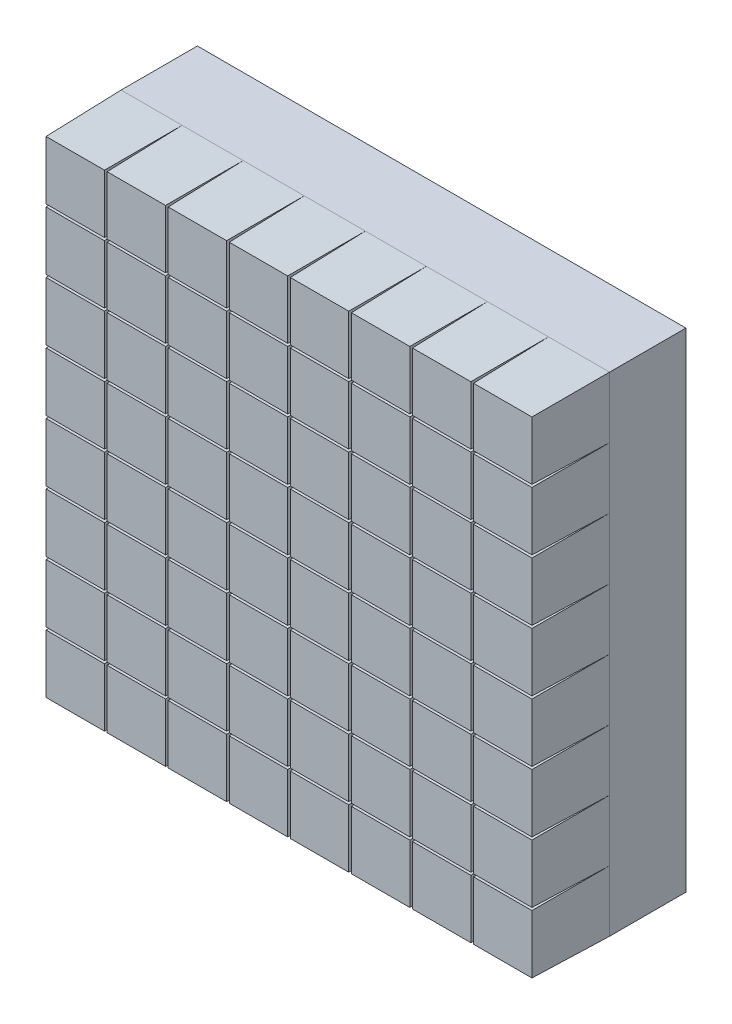
from build123d import *

# Parameters (mm, degrees)
SKETCH_2_W          = 64
SKETCH_2_H          = 64
EXTRUDE_2_DEPTH     = 10
SKETCH_4_W          = 8
SKETCH_4_H          = 8
EXTRUDE_10_DEPTH    = 10
EXTRUDE_10_TAPER    = 1
EXTRUDE_10_2_DEPTH  = 10
EXTRUDE_10_2_TAPER  = 1
EXTRUDE_10_3_DEPTH  = 10
EXTRUDE_10_3_TAPER  = 1
EXTRUDE_10_4_DEPTH  = 10
EXTRUDE_10_4_TAPER  = 1
EXTRUDE_10_5_DEPTH  = 10
EXTRUDE_10_5_TAPER  = 1
EXTRUDE_10_6_DEPTH  = 10
EXTRUDE_10_6_TAPER  = 1
EXTRUDE_10_7_DEPTH  = 10
EXTRUDE_10_7_TAPER  = 1
EXTRUDE_10_8_DEPTH  = 10
EXTRUDE_10_8_TAPER  = 1
EXTRUDE_10_9_DEPTH  = 10
EXTRUDE_10_9_TAPER  = 1
EXTRUDE_10_10_DEPTH = 10
EXTRUDE_10_10_TAPER = 1
EXTRUDE_10_11_DEPTH = 10
EXTRUDE_10_11_TAPER = 1
EXTRUDE_10_12_DEPTH = 10
EXTRUDE_10_12_TAPER = 1
EXTRUDE_10_13_DEPTH = 10
EXTRUDE_10_13_TAPER = 1
EXTRUDE_10_14_DEPTH = 10
EXTRUDE_10_14_TAPER = 1
EXTRUDE_10_15_DEPTH = 10
EXTRUDE_10_15_TAPER = 1
EXTRUDE_10_16_DEPTH = 10
EXTRUDE_10_16_TAPER = 1
EXTRUDE_10_17_DEPTH = 10
EXTRUDE_10_17_TAPER = 1
EXTRUDE_10_18_DEPTH = 10
EXTRUDE_10_18_TAPER = 1
EXTRUDE_10_19_DEPTH = 10
EXTRUDE_10_19_TAPER = 1
EXTRUDE_10_20_DEPTH = 10
EXTRUDE_10_20_TAPER = 1
EXTRUDE_10_21_DEPTH = 10
EXTRUDE_10_21_TAPER = 1
EXTRUDE_10_22_DEPTH = 10
EXTRUDE_10_22_TAPER = 1
EXTRUDE_10_23_DEPTH = 10
EXTRUDE_10_23_TAPER = 1
EXTRUDE_10_24_DEPTH = 10
EXTRUDE_10_24_TAPER = 1
EXTRUDE_10_25_DEPTH = 10
EXTRUDE_10_25_TAPER = 1
EXTRUDE_10_26_DEPTH = 10
EXTRUDE_10_26_TAPER = 1
EXTRUDE_10_27_DEPTH = 10
EXTRUDE_10_27_TAPER = 1
EXTRUDE_10_28_DEPTH = 10
EXTRUDE_10_28_TAPER = 1
EXTRUDE_10_29_DEPTH = 10
EXTRUDE_10_29_TAPER = 1
EXTRUDE_10_30_DEPTH = 10
EXTRUDE_10_30_TAPER = 1
EXTRUDE_10_31_DEPTH = 10
EXTRUDE_10_31_TAPER = 1
EXTRUDE_10_32_DEPTH = 10
EXTRUDE_10_32_TAPER = 1
SKETCH_4_5_W        = 8
SKETCH_4_5_H        = 8
EXTRUDE_11_DEPTH    = 10
EXTRUDE_11_TAPER    = 1
EXTRUDE_11_2_DEPTH  = 10
EXTRUDE_11_2_TAPER  = 1
EXTRUDE_11_3_DEPTH  = 10
EXTRUDE_11_3_TAPER  = 1
EXTRUDE_11_4_DEPTH  = 10
EXTRUDE_11_4_TAPER  = 1
EXTRUDE_11_5_DEPTH  = 10
EXTRUDE_11_5_TAPER  = 1
EXTRUDE_11_6_DEPTH  = 10
EXTRUDE_11_6_TAPER  = 1
EXTRUDE_11_7_DEPTH  = 10
EXTRUDE_11_7_TAPER  = 1
EXTRUDE_11_8_DEPTH  = 10
EXTRUDE_11_8_TAPER  = 1
EXTRUDE_11_9_DEPTH  = 10
EXTRUDE_11_9_TAPER  = 1
EXTRUDE_11_10_DEPTH = 10
EXTRUDE_11_10_TAPER = 1
EXTRUDE_11_11_DEPTH = 10
EXTRUDE_11_11_TAPER = 1
EXTRUDE_11_12_DEPTH = 10
EXTRUDE_11_12_TAPER = 1
EXTRUDE_11_13_DEPTH = 10
EXTRUDE_11_13_TAPER = 1
EXTRUDE_11_14_DEPTH = 10
EXTRUDE_11_14_TAPER = 1
EXTRUDE_11_15_DEPTH = 10
EXTRUDE_11_15_TAPER = 1
EXTRUDE_11_16_DEPTH = 10
EXTRUDE_11_16_TAPER = 1
EXTRUDE_11_17_DEPTH = 10
EXTRUDE_11_17_TAPER = 1
EXTRUDE_11_18_DEPTH = 10
EXTRUDE_11_18_TAPER = 1
EXTRUDE_11_19_DEPTH = 10
EXTRUDE_11_19_TAPER = 1
EXTRUDE_11_20_DEPTH = 10
EXTRUDE_11_20_TAPER = 1
EXTRUDE_11_21_DEPTH = 10
EXTRUDE_11_21_TAPER = 1
EXTRUDE_11_22_DEPTH = 10
EXTRUDE_11_22_TAPER = 1
EXTRUDE_11_23_DEPTH = 10
EXTRUDE_11_23_TAPER = 1
EXTRUDE_11_24_DEPTH = 10
EXTRUDE_11_24_TAPER = 1
EXTRUDE_11_25_DEPTH = 10
EXTRUDE_11_25_TAPER = 1
EXTRUDE_11_26_DEPTH = 10
EXTRUDE_11_26_TAPER = 1
EXTRUDE_11_27_DEPTH = 10
EXTRUDE_11_27_TAPER = 1
EXTRUDE_11_28_DEPTH = 10
EXTRUDE_11_28_TAPER = 1
EXTRUDE_11_29_DEPTH = 10
EXTRUDE_11_29_TAPER = 1
EXTRUDE_11_30_DEPTH = 10
EXTRUDE_11_30_TAPER = 1
EXTRUDE_11_31_DEPTH = 10
EXTRUDE_11_31_TAPER = 1
EXTRUDE_11_32_DEPTH = 10
EXTRUDE_11_32_TAPER = 1


with BuildPart() as part:
    # Эскиз2 → Бобышка-Вытянуть2 (new body)
    with BuildSketch(Plane.XY):
        with Locations((32, 32)):
            Rectangle(SKETCH_2_W, SKETCH_2_H)
    extrude(amount=EXTRUDE_2_DEPTH)


with BuildPart() as body_2:
    # Эскиз4 → Бобышка-Вытянуть10 (new body)
    with BuildSketch(Plane.XY.offset(10)):
        with Locations((4, 60)):
            Rectangle(SKETCH_4_W, SKETCH_4_H)
    extrude(amount=EXTRUDE_10_DEPTH, taper=EXTRUDE_10_TAPER)


with BuildPart() as body_3:
    # Эскиз4 → Extrude 10 2 (new body)
    with BuildSketch(Plane.XY.offset(10)):
        with Locations((4, 44)):
            Rectangle(SKETCH_4_W, SKETCH_4_H)
    extrude(amount=EXTRUDE_10_2_DEPTH, taper=EXTRUDE_10_2_TAPER)


with BuildPart() as body_4:
    # Эскиз4 → Extrude 10 3 (new body)
    with BuildSketch(Plane.XY.offset(10)):
        with Locations((12, 52)):
            Rectangle(SKETCH_4_W, SKETCH_4_H)
    extrude(amount=EXTRUDE_10_3_DEPTH, taper=EXTRUDE_10_3_TAPER)


with BuildPart() as body_5:
    # Эскиз4 → Extrude 10 4 (new body)
    with BuildSketch(Plane.XY.offset(10)):
        with Locations((20, 60)):
            Rectangle(SKETCH_4_W, SKETCH_4_H)
    extrude(amount=EXTRUDE_10_4_DEPTH, taper=EXTRUDE_10_4_TAPER)


with BuildPart() as body_6:
    # Эскиз4 → Extrude 10 5 (new body)
    with BuildSketch(Plane.XY.offset(10)):
        with Locations((4, 28)):
            Rectangle(SKETCH_4_W, SKETCH_4_H)
    extrude(amount=EXTRUDE_10_5_DEPTH, taper=EXTRUDE_10_5_TAPER)


with BuildPart() as body_7:
    # Эскиз4 → Extrude 10 6 (new body)
    with BuildSketch(Plane.XY.offset(10)):
        with Locations((12, 36)):
            Rectangle(SKETCH_4_W, SKETCH_4_H)
    extrude(amount=EXTRUDE_10_6_DEPTH, taper=EXTRUDE_10_6_TAPER)


with BuildPart() as body_8:
    # Эскиз4 → Extrude 10 7 (new body)
    with BuildSketch(Plane.XY.offset(10)):
        with Locations((20, 44)):
            Rectangle(SKETCH_4_W, SKETCH_4_H)
    extrude(amount=EXTRUDE_10_7_DEPTH, taper=EXTRUDE_10_7_TAPER)


with BuildPart() as body_9:
    # Эскиз4 → Extrude 10 8 (new body)
    with BuildSketch(Plane.XY.offset(10)):
        with Locations((28, 52)):
            Rectangle(SKETCH_4_W, SKETCH_4_H)
    extrude(amount=EXTRUDE_10_8_DEPTH, taper=EXTRUDE_10_8_TAPER)


with BuildPart() as body_10:
    # Эскиз4 → Extrude 10 9 (new body)
    with BuildSketch(Plane.XY.offset(10)):
        with Locations((36, 60)):
            Rectangle(SKETCH_4_W, SKETCH_4_H)
    extrude(amount=EXTRUDE_10_9_DEPTH, taper=EXTRUDE_10_9_TAPER)


with BuildPart() as body_11:
    # Эскиз4 → Extrude 10 10 (new body)
    with BuildSketch(Plane.XY.offset(10)):
        with Locations((4, 12)):
            Rectangle(SKETCH_4_W, SKETCH_4_H)
    extrude(amount=EXTRUDE_10_10_DEPTH, taper=EXTRUDE_10_10_TAPER)


with BuildPart() as body_12:
    # Эскиз4 → Extrude 10 11 (new body)
    with BuildSketch(Plane.XY.offset(10)):
        with Locations((12, 20)):
            Rectangle(SKETCH_4_W, SKETCH_4_H)
    extrude(amount=EXTRUDE_10_11_DEPTH, taper=EXTRUDE_10_11_TAPER)


with BuildPart() as body_13:
    # Эскиз4 → Extrude 10 12 (new body)
    with BuildSketch(Plane.XY.offset(10)):
        with Locations((20, 28)):
            Rectangle(SKETCH_4_W, SKETCH_4_H)
    extrude(amount=EXTRUDE_10_12_DEPTH, taper=EXTRUDE_10_12_TAPER)


with BuildPart() as body_14:
    # Эскиз4 → Extrude 10 13 (new body)
    with BuildSketch(Plane.XY.offset(10)):
        with Locations((28, 36)):
            Rectangle(SKETCH_4_W, SKETCH_4_H)
    extrude(amount=EXTRUDE_10_13_DEPTH, taper=EXTRUDE_10_13_TAPER)


with BuildPart() as body_15:
    # Эскиз4 → Extrude 10 14 (new body)
    with BuildSketch(Plane.XY.offset(10)):
        with Locations((36, 44)):
            Rectangle(SKETCH_4_W, SKETCH_4_H)
    extrude(amount=EXTRUDE_10_14_DEPTH, taper=EXTRUDE_10_14_TAPER)


with BuildPart() as body_16:
    # Эскиз4 → Extrude 10 15 (new body)
    with BuildSketch(Plane.XY.offset(10)):
        with Locations((44, 52)):
            Rectangle(SKETCH_4_W, SKETCH_4_H)
    extrude(amount=EXTRUDE_10_15_DEPTH, taper=EXTRUDE_10_15_TAPER)


with BuildPart() as body_17:
    # Эскиз4 → Extrude 10 16 (new body)
    with BuildSketch(Plane.XY.offset(10)):
        with Locations((52, 60)):
            Rectangle(SKETCH_4_W, SKETCH_4_H)
    extrude(amount=EXTRUDE_10_16_DEPTH, taper=EXTRUDE_10_16_TAPER)


with BuildPart() as body_18:
    # Эскиз4 → Extrude 10 17 (new body)
    with BuildSketch(Plane.XY.offset(10)):
        with Locations((12, 4)):
            Rectangle(SKETCH_4_W, SKETCH_4_H)
    extrude(amount=EXTRUDE_10_17_DEPTH, taper=EXTRUDE_10_17_TAPER)


with BuildPart() as body_19:
    # Эскиз4 → Extrude 10 18 (new body)
    with BuildSketch(Plane.XY.offset(10)):
        with Locations((20, 12)):
            Rectangle(SKETCH_4_W, SKETCH_4_H)
    extrude(amount=EXTRUDE_10_18_DEPTH, taper=EXTRUDE_10_18_TAPER)


with BuildPart() as body_20:
    # Эскиз4 → Extrude 10 19 (new body)
    with BuildSketch(Plane.XY.offset(10)):
        with Locations((28, 20)):
            Rectangle(SKETCH_4_W, SKETCH_4_H)
    extrude(amount=EXTRUDE_10_19_DEPTH, taper=EXTRUDE_10_19_TAPER)


with BuildPart() as body_21:
    # Эскиз4 → Extrude 10 20 (new body)
    with BuildSketch(Plane.XY.offset(10)):
        with Locations((36, 28)):
            Rectangle(SKETCH_4_W, SKETCH_4_H)
    extrude(amount=EXTRUDE_10_20_DEPTH, taper=EXTRUDE_10_20_TAPER)


with BuildPart() as body_22:
    # Эскиз4 → Extrude 10 21 (new body)
    with BuildSketch(Plane.XY.offset(10)):
        with Locations((44, 36)):
            Rectangle(SKETCH_4_W, SKETCH_4_H)
    extrude(amount=EXTRUDE_10_21_DEPTH, taper=EXTRUDE_10_21_TAPER)


with BuildPart() as body_23:
    # Эскиз4 → Extrude 10 22 (new body)
    with BuildSketch(Plane.XY.offset(10)):
        with Locations((52, 44)):
            Rectangle(SKETCH_4_W, SKETCH_4_H)
    extrude(amount=EXTRUDE_10_22_DEPTH, taper=EXTRUDE_10_22_TAPER)


with BuildPart() as body_24:
    # Эскиз4 → Extrude 10 23 (new body)
    with BuildSketch(Plane.XY.offset(10)):
        with Locations((60, 52)):
            Rectangle(SKETCH_4_W, SKETCH_4_H)
    extrude(amount=EXTRUDE_10_23_DEPTH, taper=EXTRUDE_10_23_TAPER)


with BuildPart() as body_25:
    # Эскиз4 → Extrude 10 24 (new body)
    with BuildSketch(Plane.XY.offset(10)):
        with Locations((28, 4)):
            Rectangle(SKETCH_4_W, SKETCH_4_H)
    extrude(amount=EXTRUDE_10_24_DEPTH, taper=EXTRUDE_10_24_TAPER)


with BuildPart() as body_26:
    # Эскиз4 → Extrude 10 25 (new body)
    with BuildSketch(Plane.XY.offset(10)):
        with Locations((36, 12)):
            Rectangle(SKETCH_4_W, SKETCH_4_H)
    extrude(amount=EXTRUDE_10_25_DEPTH, taper=EXTRUDE_10_25_TAPER)


with BuildPart() as body_27:
    # Эскиз4 → Extrude 10 26 (new body)
    with BuildSketch(Plane.XY.offset(10)):
        with Locations((44, 20)):
            Rectangle(SKETCH_4_W, SKETCH_4_H)
    extrude(amount=EXTRUDE_10_26_DEPTH, taper=EXTRUDE_10_26_TAPER)


with BuildPart() as body_28:
    # Эскиз4 → Extrude 10 27 (new body)
    with BuildSketch(Plane.XY.offset(10)):
        with Locations((52, 28)):
            Rectangle(SKETCH_4_W, SKETCH_4_H)
    extrude(amount=EXTRUDE_10_27_DEPTH, taper=EXTRUDE_10_27_TAPER)


with BuildPart() as body_29:
    # Эскиз4 → Extrude 10 28 (new body)
    with BuildSketch(Plane.XY.offset(10)):
        with Locations((60, 36)):
            Rectangle(SKETCH_4_W, SKETCH_4_H)
    extrude(amount=EXTRUDE_10_28_DEPTH, taper=EXTRUDE_10_28_TAPER)


with BuildPart() as body_30:
    # Эскиз4 → Extrude 10 29 (new body)
    with BuildSketch(Plane.XY.offset(10)):
        with Locations((44, 4)):
            Rectangle(SKETCH_4_W, SKETCH_4_H)
    extrude(amount=EXTRUDE_10_29_DEPTH, taper=EXTRUDE_10_29_TAPER)


with BuildPart() as body_31:
    # Эскиз4 → Extrude 10 30 (new body)
    with BuildSketch(Plane.XY.offset(10)):
        with Locations((52, 12)):
            Rectangle(SKETCH_4_W, SKETCH_4_H)
    extrude(amount=EXTRUDE_10_30_DEPTH, taper=EXTRUDE_10_30_TAPER)


with BuildPart() as body_32:
    # Эскиз4 → Extrude 10 31 (new body)
    with BuildSketch(Plane.XY.offset(10)):
        with Locations((60, 20)):
            Rectangle(SKETCH_4_W, SKETCH_4_H)
    extrude(amount=EXTRUDE_10_31_DEPTH, taper=EXTRUDE_10_31_TAPER)


with BuildPart() as body_33:
    # Эскиз4 → Extrude 10 32 (new body)
    with BuildSketch(Plane.XY.offset(10)):
        with Locations((60, 4)):
            Rectangle(SKETCH_4_W, SKETCH_4_H)
    extrude(amount=EXTRUDE_10_32_DEPTH, taper=EXTRUDE_10_32_TAPER)


with BuildPart() as body_34:
    # Эскиз4<5> → Бобышка-Вытянуть11 (new body)
    with BuildSketch(Plane.XY.offset(10)):
        with Locations((4, 52)):
            Rectangle(SKETCH_4_5_W, SKETCH_4_5_H)
    extrude(amount=EXTRUDE_11_DEPTH, taper=EXTRUDE_11_TAPER)


with BuildPart() as body_35:
    # Эскиз4<5> → Extrude 11 2 (new body)
    with BuildSketch(Plane.XY.offset(10)):
        with Locations((12, 60)):
            Rectangle(SKETCH_4_5_W, SKETCH_4_5_H)
    extrude(amount=EXTRUDE_11_2_DEPTH, taper=EXTRUDE_11_2_TAPER)


with BuildPart() as body_36:
    # Эскиз4<5> → Extrude 11 3 (new body)
    with BuildSketch(Plane.XY.offset(10)):
        with Locations((4, 36)):
            Rectangle(SKETCH_4_5_W, SKETCH_4_5_H)
    extrude(amount=EXTRUDE_11_3_DEPTH, taper=EXTRUDE_11_3_TAPER)


with BuildPart() as body_37:
    # Эскиз4<5> → Extrude 11 4 (new body)
    with BuildSketch(Plane.XY.offset(10)):
        with Locations((12, 44)):
            Rectangle(SKETCH_4_5_W, SKETCH_4_5_H)
    extrude(amount=EXTRUDE_11_4_DEPTH, taper=EXTRUDE_11_4_TAPER)


with BuildPart() as body_38:
    # Эскиз4<5> → Extrude 11 5 (new body)
    with BuildSketch(Plane.XY.offset(10)):
        with Locations((20, 52)):
            Rectangle(SKETCH_4_5_W, SKETCH_4_5_H)
    extrude(amount=EXTRUDE_11_5_DEPTH, taper=EXTRUDE_11_5_TAPER)


with BuildPart() as body_39:
    # Эскиз4<5> → Extrude 11 6 (new body)
    with BuildSketch(Plane.XY.offset(10)):
        with Locations((28, 60)):
            Rectangle(SKETCH_4_5_W, SKETCH_4_5_H)
    extrude(amount=EXTRUDE_11_6_DEPTH, taper=EXTRUDE_11_6_TAPER)


with BuildPart() as body_40:
    # Эскиз4<5> → Extrude 11 7 (new body)
    with BuildSketch(Plane.XY.offset(10)):
        with Locations((4, 20)):
            Rectangle(SKETCH_4_5_W, SKETCH_4_5_H)
    extrude(amount=EXTRUDE_11_7_DEPTH, taper=EXTRUDE_11_7_TAPER)


with BuildPart() as body_41:
    # Эскиз4<5> → Extrude 11 8 (new body)
    with BuildSketch(Plane.XY.offset(10)):
        with Locations((12, 28)):
            Rectangle(SKETCH_4_5_W, SKETCH_4_5_H)
    extrude(amount=EXTRUDE_11_8_DEPTH, taper=EXTRUDE_11_8_TAPER)


with BuildPart() as body_42:
    # Эскиз4<5> → Extrude 11 9 (new body)
    with BuildSketch(Plane.XY.offset(10)):
        with Locations((20, 36)):
            Rectangle(SKETCH_4_5_W, SKETCH_4_5_H)
    extrude(amount=EXTRUDE_11_9_DEPTH, taper=EXTRUDE_11_9_TAPER)


with BuildPart() as body_43:
    # Эскиз4<5> → Extrude 11 10 (new body)
    with BuildSketch(Plane.XY.offset(10)):
        with Locations((28, 44)):
            Rectangle(SKETCH_4_5_W, SKETCH_4_5_H)
    extrude(amount=EXTRUDE_11_10_DEPTH, taper=EXTRUDE_11_10_TAPER)


with BuildPart() as body_44:
    # Эскиз4<5> → Extrude 11 11 (new body)
    with BuildSketch(Plane.XY.offset(10)):
        with Locations((36, 52)):
            Rectangle(SKETCH_4_5_W, SKETCH_4_5_H)
    extrude(amount=EXTRUDE_11_11_DEPTH, taper=EXTRUDE_11_11_TAPER)


with BuildPart() as body_45:
    # Эскиз4<5> → Extrude 11 12 (new body)
    with BuildSketch(Plane.XY.offset(10)):
        with Locations((44, 60)):
            Rectangle(SKETCH_4_5_W, SKETCH_4_5_H)
    extrude(amount=EXTRUDE_11_12_DEPTH, taper=EXTRUDE_11_12_TAPER)


with BuildPart() as body_46:
    # Эскиз4<5> → Extrude 11 13 (new body)
    with BuildSketch(Plane.XY.offset(10)):
        with Locations((4, 4)):
            Rectangle(SKETCH_4_5_W, SKETCH_4_5_H)
    extrude(amount=EXTRUDE_11_13_DEPTH, taper=EXTRUDE_11_13_TAPER)


with BuildPart() as body_47:
    # Эскиз4<5> → Extrude 11 14 (new body)
    with BuildSketch(Plane.XY.offset(10)):
        with Locations((12, 12)):
            Rectangle(SKETCH_4_5_W, SKETCH_4_5_H)
    extrude(amount=EXTRUDE_11_14_DEPTH, taper=EXTRUDE_11_14_TAPER)


with BuildPart() as body_48:
    # Эскиз4<5> → Extrude 11 15 (new body)
    with BuildSketch(Plane.XY.offset(10)):
        with Locations((20, 20)):
            Rectangle(SKETCH_4_5_W, SKETCH_4_5_H)
    extrude(amount=EXTRUDE_11_15_DEPTH, taper=EXTRUDE_11_15_TAPER)


with BuildPart() as body_49:
    # Эскиз4<5> → Extrude 11 16 (new body)
    with BuildSketch(Plane.XY.offset(10)):
        with Locations((28, 28)):
            Rectangle(SKETCH_4_5_W, SKETCH_4_5_H)
    extrude(amount=EXTRUDE_11_16_DEPTH, taper=EXTRUDE_11_16_TAPER)


with BuildPart() as body_50:
    # Эскиз4<5> → Extrude 11 17 (new body)
    with BuildSketch(Plane.XY.offset(10)):
        with Locations((36, 36)):
            Rectangle(SKETCH_4_5_W, SKETCH_4_5_H)
    extrude(amount=EXTRUDE_11_17_DEPTH, taper=EXTRUDE_11_17_TAPER)


with BuildPart() as body_51:
    # Эскиз4<5> → Extrude 11 18 (new body)
    with BuildSketch(Plane.XY.offset(10)):
        with Locations((44, 44)):
            Rectangle(SKETCH_4_5_W, SKETCH_4_5_H)
    extrude(amount=EXTRUDE_11_18_DEPTH, taper=EXTRUDE_11_18_TAPER)


with BuildPart() as body_52:
    # Эскиз4<5> → Extrude 11 19 (new body)
    with BuildSketch(Plane.XY.offset(10)):
        with Locations((52, 52)):
            Rectangle(SKETCH_4_5_W, SKETCH_4_5_H)
    extrude(amount=EXTRUDE_11_19_DEPTH, taper=EXTRUDE_11_19_TAPER)


with BuildPart() as body_53:
    # Эскиз4<5> → Extrude 11 20 (new body)
    with BuildSketch(Plane.XY.offset(10)):
        with Locations((60, 60)):
            Rectangle(SKETCH_4_5_W, SKETCH_4_5_H)
    extrude(amount=EXTRUDE_11_20_DEPTH, taper=EXTRUDE_11_20_TAPER)


with BuildPart() as body_54:
    # Эскиз4<5> → Extrude 11 21 (new body)
    with BuildSketch(Plane.XY.offset(10)):
        with Locations((20, 4)):
            Rectangle(SKETCH_4_5_W, SKETCH_4_5_H)
    extrude(amount=EXTRUDE_11_21_DEPTH, taper=EXTRUDE_11_21_TAPER)


with BuildPart() as body_55:
    # Эскиз4<5> → Extrude 11 22 (new body)
    with BuildSketch(Plane.XY.offset(10)):
        with Locations((28, 12)):
            Rectangle(SKETCH_4_5_W, SKETCH_4_5_H)
    extrude(amount=EXTRUDE_11_22_DEPTH, taper=EXTRUDE_11_22_TAPER)


with BuildPart() as body_56:
    # Эскиз4<5> → Extrude 11 23 (new body)
    with BuildSketch(Plane.XY.offset(10)):
        with Locations((36, 20)):
            Rectangle(SKETCH_4_5_W, SKETCH_4_5_H)
    extrude(amount=EXTRUDE_11_23_DEPTH, taper=EXTRUDE_11_23_TAPER)


with BuildPart() as body_57:
    # Эскиз4<5> → Extrude 11 24 (new body)
    with BuildSketch(Plane.XY.offset(10)):
        with Locations((44, 28)):
            Rectangle(SKETCH_4_5_W, SKETCH_4_5_H)
    extrude(amount=EXTRUDE_11_24_DEPTH, taper=EXTRUDE_11_24_TAPER)


with BuildPart() as body_58:
    # Эскиз4<5> → Extrude 11 25 (new body)
    with BuildSketch(Plane.XY.offset(10)):
        with Locations((52, 36)):
            Rectangle(SKETCH_4_5_W, SKETCH_4_5_H)
    extrude(amount=EXTRUDE_11_25_DEPTH, taper=EXTRUDE_11_25_TAPER)


with BuildPart() as body_59:
    # Эскиз4<5> → Extrude 11 26 (new body)
    with BuildSketch(Plane.XY.offset(10)):
        with Locations((60, 44)):
            Rectangle(SKETCH_4_5_W, SKETCH_4_5_H)
    extrude(amount=EXTRUDE_11_26_DEPTH, taper=EXTRUDE_11_26_TAPER)


with BuildPart() as body_60:
    # Эскиз4<5> → Extrude 11 27 (new body)
    with BuildSketch(Plane.XY.offset(10)):
        with Locations((36, 4)):
            Rectangle(SKETCH_4_5_W, SKETCH_4_5_H)
    extrude(amount=EXTRUDE_11_27_DEPTH, taper=EXTRUDE_11_27_TAPER)


with BuildPart() as body_61:
    # Эскиз4<5> → Extrude 11 28 (new body)
    with BuildSketch(Plane.XY.offset(10)):
        with Locations((44, 12)):
            Rectangle(SKETCH_4_5_W, SKETCH_4_5_H)
    extrude(amount=EXTRUDE_11_28_DEPTH, taper=EXTRUDE_11_28_TAPER)


with BuildPart() as body_62:
    # Эскиз4<5> → Extrude 11 29 (new body)
    with BuildSketch(Plane.XY.offset(10)):
        with Locations((52, 20)):
            Rectangle(SKETCH_4_5_W, SKETCH_4_5_H)
    extrude(amount=EXTRUDE_11_29_DEPTH, taper=EXTRUDE_11_29_TAPER)


with BuildPart() as body_63:
    # Эскиз4<5> → Extrude 11 30 (new body)
    with BuildSketch(Plane.XY.offset(10)):
        with Locations((60, 28)):
            Rectangle(SKETCH_4_5_W, SKETCH_4_5_H)
    extrude(amount=EXTRUDE_11_30_DEPTH, taper=EXTRUDE_11_30_TAPER)


with BuildPart() as body_64:
    # Эскиз4<5> → Extrude 11 31 (new body)
    with BuildSketch(Plane.XY.offset(10)):
        with Locations((52, 4)):
            Rectangle(SKETCH_4_5_W, SKETCH_4_5_H)
    extrude(amount=EXTRUDE_11_31_DEPTH, taper=EXTRUDE_11_31_TAPER)


with BuildPart() as body_65:
    # Эскиз4<5> → Extrude 11 32 (new body)
    with BuildSketch(Plane.XY.offset(10)):
        with Locations((60, 12)):
            Rectangle(SKETCH_4_5_W, SKETCH_4_5_H)
    extrude(amount=EXTRUDE_11_32_DEPTH, taper=EXTRUDE_11_32_TAPER)


solid = Compound([part.part, body_2.part, body_3.part, body_4.part, body_5.part, body_6.part, body_7.part, body_8.part, body_9.part, body_10.part, body_11.part, body_12.part, body_13.part, body_14.part, body_15.part, body_16.part, body_17.part, body_18.part, body_19.part, body_20.part, body_21.part, body_22.part, body_23.part, body_24.part, body_25.part, body_26.part, body_27.part, body_28.part, body_29.part, body_30.part, body_31.part, body_32.part, body_33.part, body_34.part, body_35.part, body_36.part, body_37.part, body_38.part, body_39.part, body_40.part, body_41.part, body_42.part, body_43.part, body_44.part, body_45.part, body_46.part, body_47.part, body_48.part, body_49.part, body_50.part, body_51.part, body_52.part, body_53.part, body_54.part, body_55.part, body_56.part, body_57.part, body_58.part, body_59.part, body_60.part, body_61.part, body_62.part, body_63.part, body_64.part, body_65.part])
